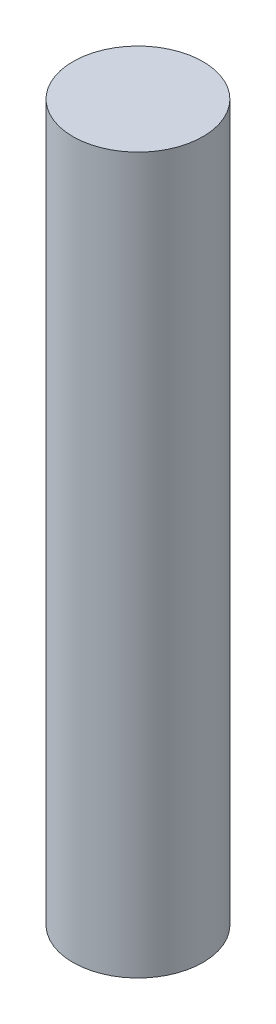
from build123d import *

# Parameters (mm, degrees)
SKETCH_1_R      = 2
EXTRUDE_1_DEPTH = 22


with BuildPart() as part:
    # 草图1 → 凸台-拉伸1 (new body)
    with BuildSketch(Plane(origin=(0, 0, 0), x_dir=(1, 0, 0), z_dir=(0, 1, 0))):
        with Locations(Location((0, 0, 0), (0, 0, 270))):
            Circle(SKETCH_1_R)
    extrude(amount=EXTRUDE_1_DEPTH)


solid = part.part
